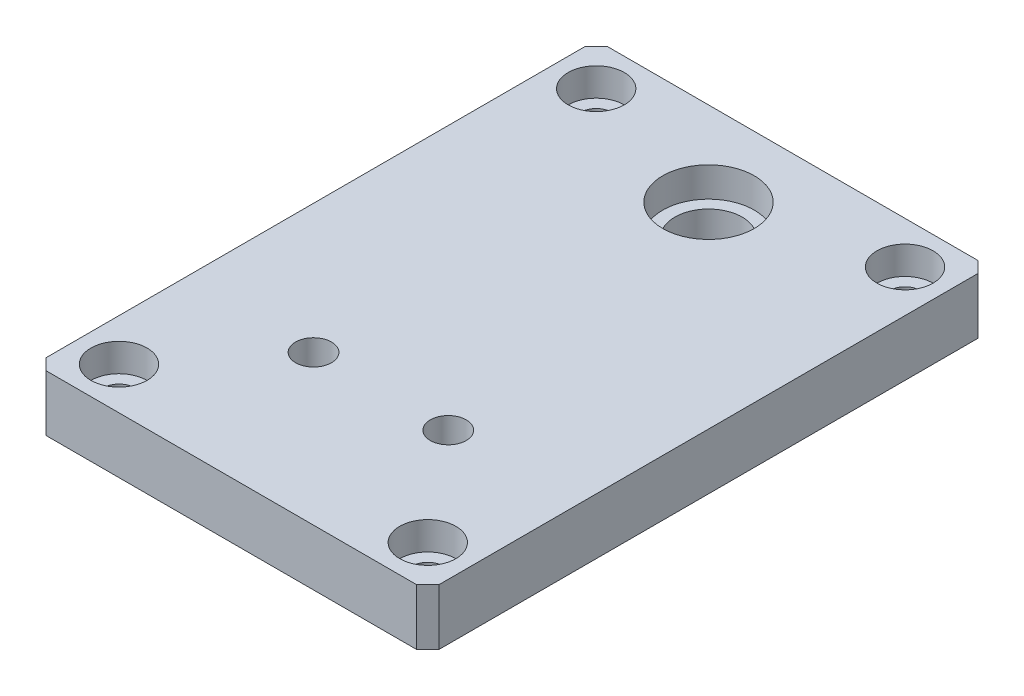
from build123d import *

# Parameters (mm, degrees)
SKETCH1_W                      = 70
SKETCH1_H                      = 100
BOSS_EXTRUDE1_DEPTH            = 10
CBORE_FOR_M5_SHCS1_D           = 5.5
CBORE_FOR_M5_SHCS1_CBORE_D     = 10
CBORE_FOR_M5_SHCS1_CBORE_DEPTH = 5
F_1_0MM_DOWEL_HOLE1_D          = 16.3
F_1_0MM_DOWEL_HOLE1_DEPTH      = 5.3
F_1_0MM_DOWEL_HOLE3_D          = 12
SKETCH14_R                     = 3.2
CUT_EXTRUDE1_DEPTH             = 62.846584384
CHAMFER1_SIZE                  = 2


with BuildPart() as part:
    # Sketch1 → Boss-Extrude1 (new body)
    with BuildSketch(Plane(origin=(0, 0, 0), x_dir=(1, 0, 0), z_dir=(0, 1, 0))):
        Rectangle(SKETCH1_W, SKETCH1_H)
    extrude(amount=BOSS_EXTRUDE1_DEPTH)

    # CBORE for M5 SHCS1 (through all)
    with Locations(Plane(origin=(0, 10, 0), x_dir=(1, 0, 0), z_dir=(0, 1, 0))):
        with Locations((-27.5, -42.5), (-27.5, 42.5), (27.5, 42.5), (27.5, -42.5)):
            CounterBoreHole(CBORE_FOR_M5_SHCS1_D / 2, CBORE_FOR_M5_SHCS1_CBORE_D / 2, CBORE_FOR_M5_SHCS1_CBORE_DEPTH)

    # Ø1.0mm Dowel Hole1
    with Locations(Plane(origin=(0, 10, 0), x_dir=(1, 0, 0), z_dir=(0, 1, 0))):
        with Locations((0, 35)):
            Hole(F_1_0MM_DOWEL_HOLE1_D / 2, depth=F_1_0MM_DOWEL_HOLE1_DEPTH)

    # Ø1.0mm Dowel Hole3 (through all)
    with Locations(Plane(origin=(0, 4.7, 0), x_dir=(1, 0, 0), z_dir=(0, 1, 0))):
        with Locations((0, 35)):
            Hole(F_1_0MM_DOWEL_HOLE3_D / 2)

    # Sketch14 → Cut-Extrude1 (cut, through all)
    with BuildSketch(Plane(origin=(0, 10, 0), x_dir=(1, 0, 0), z_dir=(0, 1, 0))):
        with Locations(Location((12, -23.35, 0), (0, 0, 270))):
            Circle(SKETCH14_R)
        with Locations(Location((-12, -23.35, 0), (0, 0, 270))):
            Circle(SKETCH14_R)
    extrude(amount=-CUT_EXTRUDE1_DEPTH, mode=Mode.SUBTRACT)

    # Chamfer1
    chamfer1_edges = [part.edges().sort_by_distance(p)[0] for p in [
        (35, 5, 50),
        (-35, 5, 50),
        (-35, 5, -50),
        (35, 5, -50),
    ]]
    chamfer(chamfer1_edges, length=CHAMFER1_SIZE)


solid = part.part
